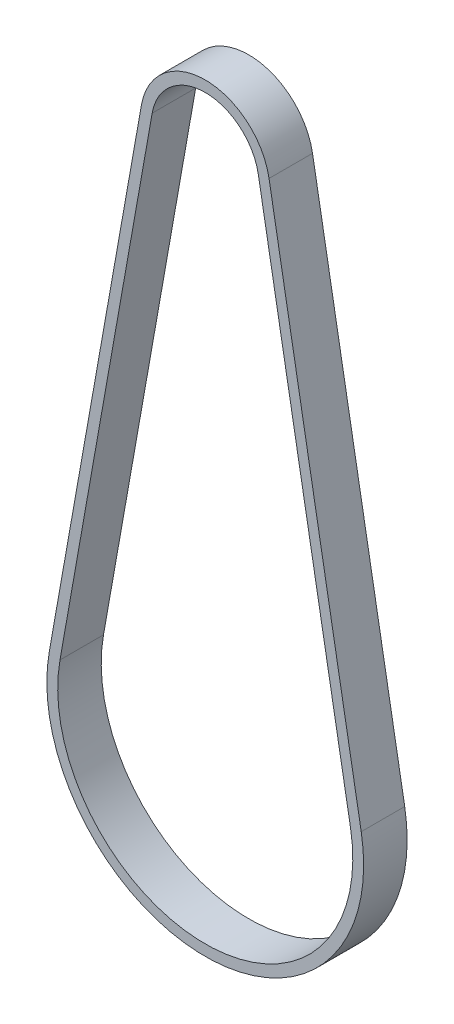
from build123d import *

# Parameters (mm, degrees)
EXTRU_MINCE1_DEPTH = 6


with BuildPart() as part:
    # Esquisse2 → Extru.-Mince1 (new body)
    with BuildSketch(Plane.XY):
        with BuildLine():
            Line((8.797604367, 1.56089154), (21.514007322, -70.112174348))
            ThreePointArc((21.514007322, -70.112174348), (0, -95.779239837), (-21.514007322, -70.112174348))
            Line((-21.514007322, -70.112174348), (-8.797604367, 1.56089154))
            ThreePointArc((-8.797604367, 1.56089154), (0, 8.935), (8.797604367, 1.56089154))
        make_face()
        with BuildLine():
            Line((7.320670226, 1.298850431), (20.037073181, -70.374215457))
            ThreePointArc((20.037073181, -70.374215457), (0, -94.279239837), (-20.037073181, -70.374215457))
            Line((-20.037073181, -70.374215457), (-7.320670226, 1.298850431))
            ThreePointArc((-7.320670226, 1.298850431), (0, 7.435), (7.320670226, 1.298850431))
        make_face(mode=Mode.SUBTRACT)
    extrude(amount=EXTRU_MINCE1_DEPTH)


solid = part.part
